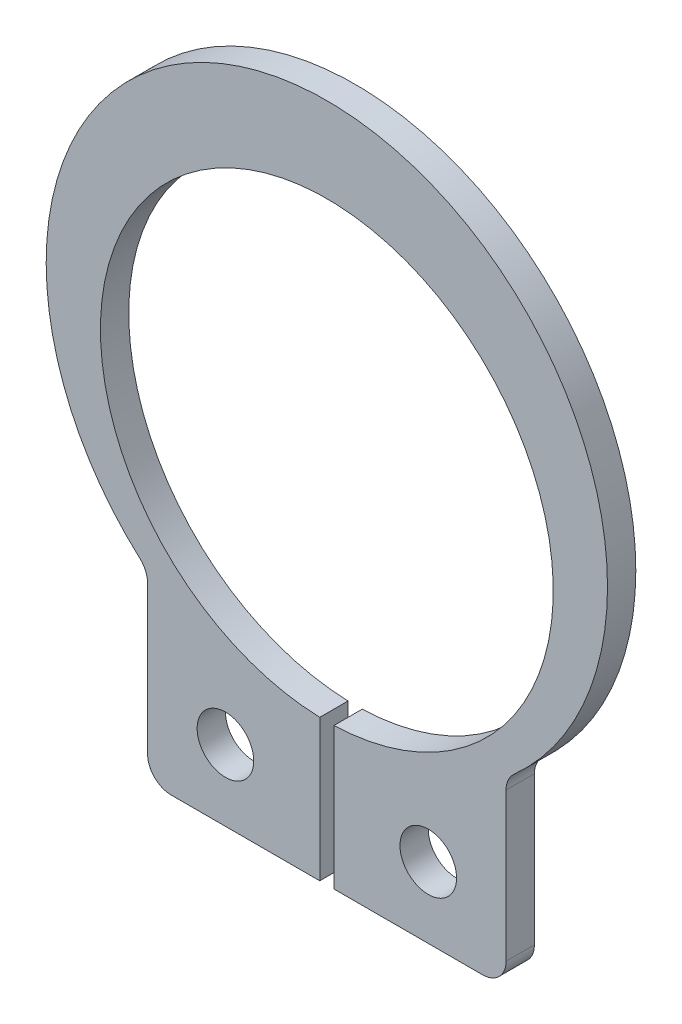
from build123d import *

# Parameters (mm, degrees)
BOSS_EXTRUDE1_DEPTH = 0.6
SKETCH2_R           = 0.6
CUT_EXTRUDE1_DEPTH  = 10.82865708


with BuildPart() as part:
    # Sketch1 → Boss-Extrude1 (new body)
    with BuildSketch(Plane.XY):
        with BuildLine():
            Line((-3.8, -4.157546152), (-3.8, -7.3))
            ThreePointArc((-3.8, -7.3), (-3.653553391, -7.653553391), (-3.3, -7.8))
            Line((-3.3, -7.8), (-0.15, -7.8))
            Line((-0.15, -7.8), (-0.15, -4.797655678))
            ThreePointArc((-0.15, -4.797655678), (0, 4.8), (0.15, -4.797655678))
            Line((0.15, -4.797655678), (0.15, -7.8))
            Line((0.15, -7.8), (3.3, -7.8))
            ThreePointArc((3.3, -7.8), (3.653553391, -7.653553391), (3.8, -7.3))
            Line((3.8, -7.3), (3.8, -4.157546152))
            ThreePointArc((3.8, -4.157546152), (3.843564535, -3.953422006), (3.966666667, -3.784868155))
            ThreePointArc((3.966666667, -3.784868155), (0, 6.6), (-3.966666667, -3.784868155))
            ThreePointArc((-3.966666667, -3.784868155), (-3.843564535, -3.953422006), (-3.8, -4.157546152))
        make_face()
    extrude(amount=-BOSS_EXTRUDE1_DEPTH)

    # Sketch2 → Cut-Extrude1 (cut, through all)
    with BuildSketch(Plane.XY):
        with Locations((-2.15, -6.3)):
            Circle(SKETCH2_R)
        with Locations((2.15, -6.3)):
            Circle(SKETCH2_R)
    extrude(amount=-CUT_EXTRUDE1_DEPTH, mode=Mode.SUBTRACT)


solid = part.part
